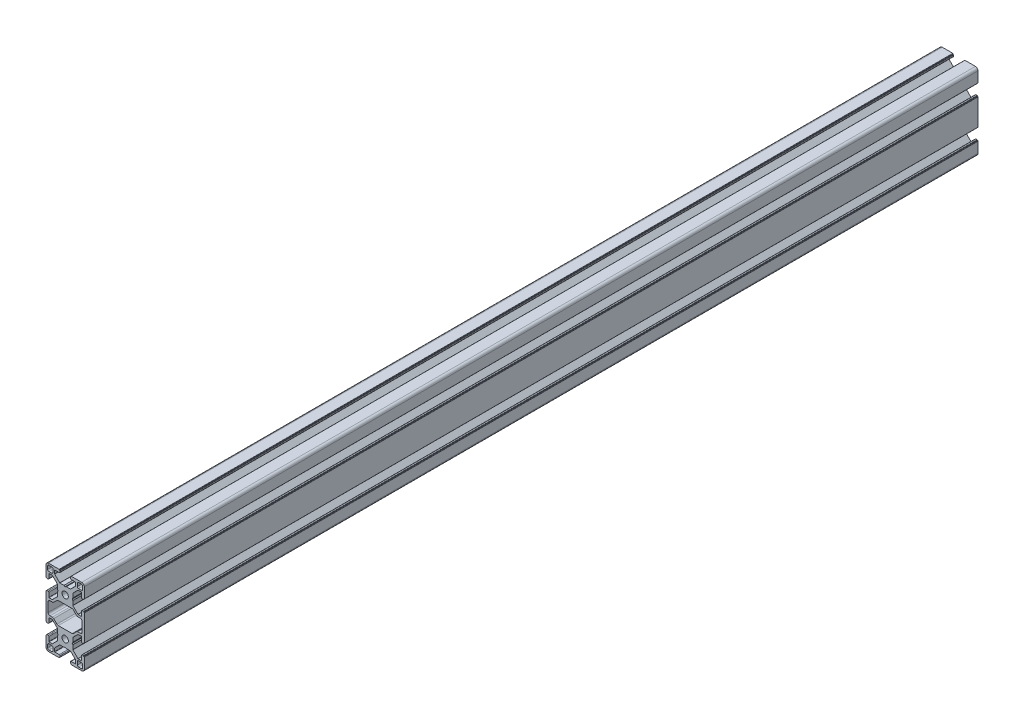
from build123d import *

# Parameters (mm, degrees)
SKETCH1_R                 = 2.45
BOSS_EXTRUDE1_DEPTH       = 700
SKETCH2_R                 = 3
CUT_EXTRUDE1_DEPTH        = 678.163200418
SKETCH3_R                 = 3
CUT_EXTRUDE2_DEPTH        = 678.827411761
M6X1_0_TAPPED_HOLE1_D     = 5
M6X1_0_TAPPED_HOLE1_DEPTH = 28
M6X1_0_TAPPED_HOLE1_TIP   = 1.502151548
M6X1_0_TAPPED_HOLE2_D     = 5
M6X1_0_TAPPED_HOLE2_DEPTH = 28
M6X1_0_TAPPED_HOLE2_TIP   = 1.502151548


with BuildPart() as part:
    # Sketch1 → Boss-Extrude1 (new body)
    with BuildSketch(Plane.XY.offset(25)):
        with BuildLine():
            Line((13.400000821, -25.95), (14.300000334, -25.95))
            ThreePointArc((14.300000334, -25.95), (14.44142169, -25.891421356), (14.500000334, -25.75))
            Line((14.500000334, -25.75), (14.500000334, -25.65))
            ThreePointArc((14.500000334, -25.65), (14.558578978, -25.508578644), (14.700000334, -25.45))
            Line((14.700000334, -25.45), (14.8, -25.45))
            ThreePointArc((14.8, -25.45), (14.941421356, -25.391421356), (15, -25.25))
            Line((15, -25.25), (15, -4.75))
            ThreePointArc((15, -4.75), (14.941421356, -4.608578644), (14.8, -4.55))
            Line((14.8, -4.55), (14.700000334, -4.55))
            ThreePointArc((14.700000334, -4.55), (14.558578978, -4.491421356), (14.500000334, -4.35))
            Line((14.500000334, -4.35), (14.500000334, -4.25))
            ThreePointArc((14.500000334, -4.25), (14.44142169, -4.108578644), (14.300000334, -4.05))
            Line((14.300000334, -4.05), (13.400000821, -4.05))
            ThreePointArc((13.400000821, -4.05), (12.975736752, -4.225735931), (12.800000821, -4.65))
            Line((12.800000821, -4.65), (12.800000821, -8.05))
            ThreePointArc((12.800000821, -8.05), (12.741422177, -8.191421356), (12.600000821, -8.25))
            Line((12.600000821, -8.25), (10.132847586, -8.25))
            ThreePointArc((10.132847586, -8.25), (10.056310912, -8.234775911), (9.991426248, -8.191421374))
            Line((9.991426248, -8.191421374), (6.06304592, -4.263042046))
            ThreePointArc((6.06304592, -4.263042046), (6.019691356, -4.19815737), (6.004467258, -4.121620672))
            Line((6.004467258, -4.121620672), (6.004467258, -0.90000009))
            Line((6.004467258, -0.90000009), (5.542586948, -0.099999736))
            ThreePointArc((5.542586948, -0.099999736), (5.515792105, 0), (5.542586948, 0.099999736))
            Line((5.542586948, 0.099999736), (6.004467258, 0.90000009))
            Line((6.004467258, 0.90000009), (6.004467258, 4.121623437))
            ThreePointArc((6.004467258, 4.121623437), (6.019691347, 4.198160112), (6.063045884, 4.263044775))
            Line((6.063045884, 4.263044775), (9.991421447, 8.191421338))
            ThreePointArc((9.991421447, 8.191421338), (10.056306123, 8.234775902), (10.132842821, 8.25))
            Line((10.132842821, 8.25), (12.600000821, 8.25))
            ThreePointArc((12.600000821, 8.25), (12.741422177, 8.191421356), (12.800000821, 8.05))
            Line((12.800000821, 8.05), (12.800000821, 4.65))
            ThreePointArc((12.800000821, 4.65), (12.975736752, 4.225735931), (13.400000821, 4.05))
            Line((13.400000821, 4.05), (14.300000334, 4.05))
            ThreePointArc((14.300000334, 4.05), (14.44142169, 4.108578644), (14.500000334, 4.25))
            Line((14.500000334, 4.25), (14.500000334, 4.350000125))
            ThreePointArc((14.500000334, 4.350000125), (14.558578978, 4.491421481), (14.700000334, 4.550000125))
            Line((14.700000334, 4.550000125), (14.8, 4.550000125))
            ThreePointArc((14.8, 4.550000125), (14.941421356, 4.608578769), (15, 4.750000125))
            Line((15, 4.750000125), (15, 13))
            ThreePointArc((15, 13), (14.414213562, 14.414213562), (13, 15))
            Line((13, 15), (4.75, 15))
            ThreePointArc((4.75, 15), (4.608578644, 14.941421356), (4.55, 14.8))
            Line((4.55, 14.8), (4.55, 14.7))
            ThreePointArc((4.55, 14.7), (4.491421356, 14.558578644), (4.35, 14.5))
            Line((4.35, 14.5), (4.25, 14.5))
            ThreePointArc((4.25, 14.5), (4.108578644, 14.441421356), (4.05, 14.3))
            Line((4.05, 14.3), (4.05, 13.4))
            ThreePointArc((4.05, 13.4), (4.225735931, 12.975735931), (4.65, 12.8))
            Line((4.65, 12.8), (8.05, 12.8))
            ThreePointArc((8.05, 12.8), (8.191421356, 12.741421356), (8.25, 12.6))
            Line((8.25, 12.6), (8.25, 10.132847492))
            ThreePointArc((8.25, 10.132847492), (8.234775904, 10.056310778), (8.191421344, 9.991426082))
            Line((8.191421344, 9.991426082), (4.258574852, 6.058578588))
            ThreePointArc((4.258574852, 6.058578588), (4.193690258, 6.015224079), (4.117153656, 6))
            Line((4.117153656, 6), (0.899999648, 6))
            Line((0.899999648, 6), (0.101934004, 5.53923672))
            ThreePointArc((0.101934004, 5.53923672), (0, 5.511923593), (-0.101934004, 5.53923672))
            Line((-0.101934004, 5.53923672), (-0.899999648, 6))
            Line((-0.899999648, 6), (-4.117156145, 6))
            ThreePointArc((-4.117156145, 6), (-4.193692724, 6.015224069), (-4.258577305, 6.058578552))
            Line((-4.258577305, 6.058578552), (-8.191421308, 9.991421554))
            ThreePointArc((-8.191421308, 9.991421554), (-8.234775894, 10.056306263), (-8.25, 10.132843))
            Line((-8.25, 10.132843), (-8.25, 12.6))
            ThreePointArc((-8.25, 12.6), (-8.191421356, 12.741421356), (-8.05, 12.8))
            Line((-8.05, 12.8), (-4.65, 12.8))
            ThreePointArc((-4.65, 12.8), (-4.225735931, 12.975735931), (-4.05, 13.4))
            Line((-4.05, 13.4), (-4.05, 14.3))
            ThreePointArc((-4.05, 14.3), (-4.108578644, 14.441421356), (-4.25, 14.5))
            Line((-4.25, 14.5), (-4.35, 14.5))
            ThreePointArc((-4.35, 14.5), (-4.491421356, 14.558578644), (-4.55, 14.7))
            Line((-4.55, 14.7), (-4.55, 14.8))
            ThreePointArc((-4.55, 14.8), (-4.608578644, 14.941421356), (-4.75, 15))
            Line((-4.75, 15), (-13, 15))
            ThreePointArc((-13, 15), (-14.414213562, 14.414213562), (-15, 13))
            Line((-15, 13), (-15, 4.750000125))
            ThreePointArc((-15, 4.750000125), (-14.941421356, 4.608578769), (-14.8, 4.550000125))
            Line((-14.8, 4.550000125), (-14.700000334, 4.550000125))
            ThreePointArc((-14.700000334, 4.550000125), (-14.558578978, 4.491421481), (-14.500000334, 4.350000125))
            Line((-14.500000334, 4.350000125), (-14.500000334, 4.25))
            ThreePointArc((-14.500000334, 4.25), (-14.44142169, 4.108578644), (-14.300000334, 4.05))
            Line((-14.300000334, 4.05), (-13.400000821, 4.05))
            ThreePointArc((-13.400000821, 4.05), (-12.975736752, 4.225735931), (-12.800000821, 4.65))
            Line((-12.800000821, 4.65), (-12.800000821, 8.05))
            ThreePointArc((-12.800000821, 8.05), (-12.741422177, 8.191421356), (-12.600000821, 8.25))
            Line((-12.600000821, 8.25), (-10.132842821, 8.25))
            ThreePointArc((-10.132842821, 8.25), (-10.056306123, 8.234775902), (-9.991421447, 8.191421338))
            Line((-9.991421447, 8.191421338), (-6.063045884, 4.263044775))
            ThreePointArc((-6.063045884, 4.263044775), (-6.019691347, 4.198160112), (-6.004467258, 4.121623437))
            Line((-6.004467258, 4.121623437), (-6.004467258, 0.90000009))
            Line((-6.004467258, 0.90000009), (-5.542586948, 0.099999736))
            ThreePointArc((-5.542586948, 0.099999736), (-5.515792105, 0), (-5.542586948, -0.099999736))
            Line((-5.542586948, -0.099999736), (-6.004467258, -0.90000009))
            Line((-6.004467258, -0.90000009), (-6.004467258, -4.121623437))
            ThreePointArc((-6.004467258, -4.121623437), (-6.019691347, -4.198160112), (-6.063045884, -4.263044775))
            Line((-6.063045884, -4.263044775), (-9.991421447, -8.191421338))
            ThreePointArc((-9.991421447, -8.191421338), (-10.056306123, -8.234775902), (-10.132842821, -8.25))
            Line((-10.132842821, -8.25), (-12.600000821, -8.25))
            ThreePointArc((-12.600000821, -8.25), (-12.741422177, -8.191421356), (-12.800000821, -8.05))
            Line((-12.800000821, -8.05), (-12.800000821, -4.65))
            ThreePointArc((-12.800000821, -4.65), (-12.975736752, -4.225735931), (-13.400000821, -4.05))
            Line((-13.400000821, -4.05), (-14.300000334, -4.05))
            ThreePointArc((-14.300000334, -4.05), (-14.44142169, -4.108578644), (-14.500000334, -4.25))
            Line((-14.500000334, -4.25), (-14.500000334, -4.35))
            ThreePointArc((-14.500000334, -4.35), (-14.558578978, -4.491421356), (-14.700000334, -4.55))
            Line((-14.700000334, -4.55), (-14.8, -4.55))
            ThreePointArc((-14.8, -4.55), (-14.941421356, -4.608578644), (-15, -4.75))
            Line((-15, -4.75), (-15, -25.25))
            ThreePointArc((-15, -25.25), (-14.941421356, -25.391421356), (-14.8, -25.45))
            Line((-14.8, -25.45), (-14.700000334, -25.45))
            ThreePointArc((-14.700000334, -25.45), (-14.558578978, -25.508578644), (-14.500000334, -25.65))
            Line((-14.500000334, -25.65), (-14.500000334, -25.75))
            ThreePointArc((-14.500000334, -25.75), (-14.44142169, -25.891421356), (-14.300000334, -25.95))
            Line((-14.300000334, -25.95), (-13.400000821, -25.95))
            ThreePointArc((-13.400000821, -25.95), (-12.975736752, -25.774264069), (-12.800000821, -25.35))
            Line((-12.800000821, -25.35), (-12.800000821, -21.95))
            ThreePointArc((-12.800000821, -21.95), (-12.741422177, -21.808578644), (-12.600000821, -21.75))
            Line((-12.600000821, -21.75), (-10.132842821, -21.75))
            ThreePointArc((-10.132842821, -21.75), (-10.056306123, -21.765224098), (-9.991421447, -21.808578662))
            Line((-9.991421447, -21.808578662), (-6.063045884, -25.736955225))
            ThreePointArc((-6.063045884, -25.736955225), (-6.019691347, -25.801839888), (-6.004467258, -25.878376563))
            Line((-6.004467258, -25.878376563), (-6.004467258, -29.09999991))
            Line((-6.004467258, -29.09999991), (-5.542586948, -29.900000264))
            ThreePointArc((-5.542586948, -29.900000264), (-5.515792105, -30), (-5.542586948, -30.099999736))
            Line((-5.542586948, -30.099999736), (-6.004467258, -30.90000009))
            Line((-6.004467258, -30.90000009), (-6.004467258, -34.121623437))
            ThreePointArc((-6.004467258, -34.121623437), (-6.019691347, -34.198160112), (-6.063045884, -34.263044775))
            Line((-6.063045884, -34.263044775), (-9.991421447, -38.191421338))
            ThreePointArc((-9.991421447, -38.191421338), (-10.056306123, -38.234775902), (-10.132842821, -38.25))
            Line((-10.132842821, -38.25), (-12.600000821, -38.25))
            ThreePointArc((-12.600000821, -38.25), (-12.741422177, -38.191421356), (-12.800000821, -38.05))
            Line((-12.800000821, -38.05), (-12.800000821, -34.65))
            ThreePointArc((-12.800000821, -34.65), (-12.975736752, -34.225735931), (-13.400000821, -34.05))
            Line((-13.400000821, -34.05), (-14.300000334, -34.05))
            ThreePointArc((-14.300000334, -34.05), (-14.44142169, -34.108578644), (-14.500000334, -34.25))
            Line((-14.500000334, -34.25), (-14.500000334, -34.350000125))
            ThreePointArc((-14.500000334, -34.350000125), (-14.558578978, -34.491421481), (-14.700000334, -34.550000125))
            Line((-14.700000334, -34.550000125), (-14.8, -34.550000125))
            ThreePointArc((-14.8, -34.550000125), (-14.941421356, -34.608578769), (-15, -34.750000125))
            Line((-15, -34.750000125), (-15, -43))
            ThreePointArc((-15, -43), (-14.414213562, -44.414213562), (-13, -45))
            Line((-13, -45), (-4.75, -45))
            ThreePointArc((-4.75, -45), (-4.608578644, -44.941421356), (-4.55, -44.8))
            Line((-4.55, -44.8), (-4.55, -44.7))
            ThreePointArc((-4.55, -44.7), (-4.491421356, -44.558578644), (-4.35, -44.5))
            Line((-4.35, -44.5), (-4.25, -44.5))
            ThreePointArc((-4.25, -44.5), (-4.108578644, -44.441421356), (-4.05, -44.3))
            Line((-4.05, -44.3), (-4.05, -43.4))
            ThreePointArc((-4.05, -43.4), (-4.225735931, -42.975735931), (-4.65, -42.8))
            Line((-4.65, -42.8), (-8.05, -42.8))
            ThreePointArc((-8.05, -42.8), (-8.191421356, -42.741421356), (-8.25, -42.6))
            Line((-8.25, -42.6), (-8.25, -40.132843))
            ThreePointArc((-8.25, -40.132843), (-8.234775894, -40.056306263), (-8.191421308, -39.991421554))
            Line((-8.191421308, -39.991421554), (-4.258577305, -36.058578552))
            ThreePointArc((-4.258577305, -36.058578552), (-4.193692724, -36.015224069), (-4.117156145, -36))
            Line((-4.117156145, -36), (-0.899999648, -36))
            Line((-0.899999648, -36), (-0.101934004, -35.53923672))
            ThreePointArc((-0.101934004, -35.53923672), (0, -35.511923593), (0.101934004, -35.53923672))
            Line((0.101934004, -35.53923672), (0.899999648, -36))
            Line((0.899999648, -36), (4.117153656, -36))
            ThreePointArc((4.117153656, -36), (4.193690258, -36.015224079), (4.258574852, -36.058578588))
            Line((4.258574852, -36.058578588), (8.191421344, -39.991426082))
            ThreePointArc((8.191421344, -39.991426082), (8.234775904, -40.056310778), (8.25, -40.132847492))
            Line((8.25, -40.132847492), (8.25, -42.6))
            ThreePointArc((8.25, -42.6), (8.191421356, -42.741421356), (8.05, -42.8))
            Line((8.05, -42.8), (4.65, -42.8))
            ThreePointArc((4.65, -42.8), (4.225735931, -42.975735931), (4.05, -43.4))
            Line((4.05, -43.4), (4.05, -44.3))
            ThreePointArc((4.05, -44.3), (4.108578644, -44.441421356), (4.25, -44.5))
            Line((4.25, -44.5), (4.35, -44.5))
            ThreePointArc((4.35, -44.5), (4.491421356, -44.558578644), (4.55, -44.7))
            Line((4.55, -44.7), (4.55, -44.8))
            ThreePointArc((4.55, -44.8), (4.608578644, -44.941421356), (4.75, -45))
            Line((4.75, -45), (13, -45))
            ThreePointArc((13, -45), (14.414213562, -44.414213562), (15, -43))
            Line((15, -43), (15, -34.750000125))
            ThreePointArc((15, -34.750000125), (14.941421356, -34.608578769), (14.8, -34.550000125))
            Line((14.8, -34.550000125), (14.700000334, -34.550000125))
            ThreePointArc((14.700000334, -34.550000125), (14.558578978, -34.491421481), (14.500000334, -34.350000125))
            Line((14.500000334, -34.350000125), (14.500000334, -34.25))
            ThreePointArc((14.500000334, -34.25), (14.44142169, -34.108578644), (14.300000334, -34.05))
            Line((14.300000334, -34.05), (13.400000821, -34.05))
            ThreePointArc((13.400000821, -34.05), (12.975736752, -34.225735931), (12.800000821, -34.65))
            Line((12.800000821, -34.65), (12.800000821, -38.05))
            ThreePointArc((12.800000821, -38.05), (12.741422177, -38.191421356), (12.600000821, -38.25))
            Line((12.600000821, -38.25), (10.132842821, -38.25))
            ThreePointArc((10.132842821, -38.25), (10.056306123, -38.234775902), (9.991421447, -38.191421338))
            Line((9.991421447, -38.191421338), (6.063045884, -34.263044775))
            ThreePointArc((6.063045884, -34.263044775), (6.019691347, -34.198160112), (6.004467258, -34.121623437))
            Line((6.004467258, -34.121623437), (6.004467258, -30.90000009))
            Line((6.004467258, -30.90000009), (5.542586948, -30.099999736))
            ThreePointArc((5.542586948, -30.099999736), (5.515792105, -30), (5.542586948, -29.900000264))
            Line((5.542586948, -29.900000264), (6.004467258, -29.09999991))
            Line((6.004467258, -29.09999991), (6.004467258, -25.878379328))
            ThreePointArc((6.004467258, -25.878379328), (6.019691356, -25.80184263), (6.06304592, -25.736957954))
            Line((6.06304592, -25.736957954), (9.991426248, -21.808578626))
            ThreePointArc((9.991426248, -21.808578626), (10.056310912, -21.765224089), (10.132847586, -21.75))
            Line((10.132847586, -21.75), (12.600000821, -21.75))
            ThreePointArc((12.600000821, -21.75), (12.741422177, -21.808578644), (12.800000821, -21.95))
            Line((12.800000821, -21.95), (12.800000821, -25.35))
            ThreePointArc((12.800000821, -25.35), (12.975736752, -25.774264069), (13.400000821, -25.95))
        make_face()
        Circle(SKETCH1_R, mode=Mode.SUBTRACT)
        with Locations((0, -30)):
            Circle(SKETCH1_R, mode=Mode.SUBTRACT)
        with BuildLine():
            Line((-9.500000904, 12.700000174), (-9.500000904, 10.500000174))
            ThreePointArc((-9.500000904, 10.500000174), (-9.792894123, 9.792893393), (-10.500000904, 9.500000174))
            Line((-10.500000904, 9.500000174), (-12.700000904, 9.500000174))
            ThreePointArc((-12.700000904, 9.500000174), (-13.407107685, 9.792893393), (-13.700000904, 10.500000174))
            Line((-13.700000904, 10.500000174), (-13.700000904, 12.700000174))
            ThreePointArc((-13.700000904, 12.700000174), (-13.407107685, 13.407106955), (-12.700000904, 13.700000174))
            Line((-12.700000904, 13.700000174), (-10.500000904, 13.700000174))
            ThreePointArc((-10.500000904, 13.700000174), (-9.792894123, 13.407106955), (-9.500000904, 12.700000174))
        make_face(mode=Mode.SUBTRACT)
        with BuildLine():
            Line((12.700000904, 9.500000174), (10.500000904, 9.500000174))
            ThreePointArc((10.500000904, 9.500000174), (9.792894123, 9.792893393), (9.500000904, 10.500000174))
            Line((9.500000904, 10.500000174), (9.500000904, 12.700000174))
            ThreePointArc((9.500000904, 12.700000174), (9.792894123, 13.407106955), (10.500000904, 13.700000174))
            Line((10.500000904, 13.700000174), (12.700000904, 13.700000174))
            ThreePointArc((12.700000904, 13.700000174), (13.407107685, 13.407106955), (13.700000904, 12.700000174))
            Line((13.700000904, 12.700000174), (13.700000904, 10.500000174))
            ThreePointArc((13.700000904, 10.500000174), (13.407107685, 9.792893393), (12.700000904, 9.500000174))
        make_face(mode=Mode.SUBTRACT)
        with BuildLine():
            Line((-12.700000904, -39.500000174), (-10.500000904, -39.500000174))
            ThreePointArc((-10.500000904, -39.500000174), (-9.792894123, -39.792893393), (-9.500000904, -40.500000174))
            Line((-9.500000904, -40.500000174), (-9.500000904, -42.700000174))
            ThreePointArc((-9.500000904, -42.700000174), (-9.792894123, -43.407106955), (-10.500000904, -43.700000174))
            Line((-10.500000904, -43.700000174), (-12.700000904, -43.700000174))
            ThreePointArc((-12.700000904, -43.700000174), (-13.407107685, -43.407106955), (-13.700000904, -42.700000174))
            Line((-13.700000904, -42.700000174), (-13.700000904, -40.500000174))
            ThreePointArc((-13.700000904, -40.500000174), (-13.407107685, -39.792893393), (-12.700000904, -39.500000174))
        make_face(mode=Mode.SUBTRACT)
        with BuildLine():
            Line((9.500000904, -42.700000174), (9.500000904, -40.500000174))
            ThreePointArc((9.500000904, -40.500000174), (9.792894123, -39.792893393), (10.500000904, -39.500000174))
            Line((10.500000904, -39.500000174), (12.700000904, -39.500000174))
            ThreePointArc((12.700000904, -39.500000174), (13.407107685, -39.792893393), (13.700000904, -40.500000174))
            Line((13.700000904, -40.500000174), (13.700000904, -42.700000174))
            ThreePointArc((13.700000904, -42.700000174), (13.407107685, -43.407106955), (12.700000904, -43.700000174))
            Line((12.700000904, -43.700000174), (10.500000904, -43.700000174))
            ThreePointArc((10.500000904, -43.700000174), (9.792894123, -43.407106955), (9.500000904, -42.700000174))
        make_face(mode=Mode.SUBTRACT)
        with BuildLine():
            Line((8.927207746, -20.539339865), (6.410354062, -23.056193892))
            ThreePointArc((6.410354062, -23.056193892), (5.923719014, -23.381353072), (5.349693818, -23.495533793))
            Line((5.349693818, -23.495533793), (-5.349693818, -23.495533793))
            ThreePointArc((-5.349693818, -23.495533793), (-5.923719014, -23.381353072), (-6.410354062, -23.056193892))
            Line((-6.410354062, -23.056193892), (-8.927207746, -20.539339865))
            ThreePointArc((-8.927207746, -20.539339865), (-9.413842755, -20.214180712), (-9.987867904, -20.1))
            Line((-9.987867904, -20.1), (-11.849999904, -20.1))
            ThreePointArc((-11.849999904, -20.1), (-12.910660076, -19.660660172), (-13.349999904, -18.6))
            Line((-13.349999904, -18.6), (-13.349999904, -11.4))
            ThreePointArc((-13.349999904, -11.4), (-12.910660076, -10.339339828), (-11.849999904, -9.9))
            Line((-11.849999904, -9.9), (-9.987867904, -9.9))
            ThreePointArc((-9.987867904, -9.9), (-9.413842755, -9.785819288), (-8.927207746, -9.460660135))
            Line((-8.927207746, -9.460660135), (-6.410354062, -6.943806108))
            ThreePointArc((-6.410354062, -6.943806108), (-5.923719014, -6.618646928), (-5.349693818, -6.504466207))
            Line((-5.349693818, -6.504466207), (5.349693818, -6.504466207))
            ThreePointArc((5.349693818, -6.504466207), (5.923719014, -6.618646928), (6.410354062, -6.943806108))
            Line((6.410354062, -6.943806108), (8.927207746, -9.460660135))
            ThreePointArc((8.927207746, -9.460660135), (9.413842755, -9.785819288), (9.987867904, -9.9))
            Line((9.987867904, -9.9), (11.849999904, -9.9))
            ThreePointArc((11.849999904, -9.9), (12.910660076, -10.339339828), (13.349999904, -11.4))
            Line((13.349999904, -11.4), (13.349999904, -18.6))
            ThreePointArc((13.349999904, -18.6), (12.910660076, -19.660660172), (11.849999904, -20.1))
            Line((11.849999904, -20.1), (9.987867904, -20.1))
            ThreePointArc((9.987867904, -20.1), (9.413842755, -20.214180712), (8.927207746, -20.539339865))
        make_face(mode=Mode.SUBTRACT)
    extrude(amount=-BOSS_EXTRUDE1_DEPTH)

    # Sketch2 → Cut-Extrude1 (cut, through all)
    with BuildSketch(Plane(origin=(15, 0, 0), x_dir=(0, 0, -1), z_dir=(1, 0, 0))):
        with Locations(Location((20, 0, 0), (0, 0, 162.542395082))):
            Circle(SKETCH2_R)
        with Locations(Location((20, -30, 0), (0, 0, 162.542395082))):
            Circle(SKETCH2_R)
        with Locations(Location((660, 0, 0), (0, 0, 162.542395082))):
            Circle(SKETCH2_R)
        with Locations(Location((660, -30, 0), (0, 0, 17.457604918))):
            Circle(SKETCH2_R)
    extrude(amount=-CUT_EXTRUDE1_DEPTH, mode=Mode.SUBTRACT)

    # Sketch3 → Cut-Extrude2 (cut, through all)
    with BuildSketch(Plane.XZ.offset(45)):
        with Locations(Location((0, -20, 0), (0, 0, 268.052830131))):
            Circle(SKETCH3_R)
        with Locations(Location((0, -660, 0), (0, 0, 270))):
            Circle(SKETCH3_R)
    extrude(amount=-CUT_EXTRUDE2_DEPTH, mode=Mode.SUBTRACT)

    # M6x1.0 Tapped Hole1
    with Locations(Plane.XY.offset(25)):
        with Locations((0, 0), (0, -30)):
            Hole(M6X1_0_TAPPED_HOLE1_D / 2, depth=M6X1_0_TAPPED_HOLE1_DEPTH)
            with Locations((0, 0, -(M6X1_0_TAPPED_HOLE1_DEPTH + M6X1_0_TAPPED_HOLE1_TIP / 2))):  # 118° drill point
                Cone(0, M6X1_0_TAPPED_HOLE1_D / 2, M6X1_0_TAPPED_HOLE1_TIP, mode=Mode.SUBTRACT)

    # M6x1.0 Tapped Hole2
    with Locations(Plane(origin=(0, 0, -675), x_dir=(-1, 0, 0), z_dir=(0, 0, -1))):
        with Locations((0, 0), (0, -30)):
            Hole(M6X1_0_TAPPED_HOLE2_D / 2, depth=M6X1_0_TAPPED_HOLE2_DEPTH)
            with Locations((0, 0, -(M6X1_0_TAPPED_HOLE2_DEPTH + M6X1_0_TAPPED_HOLE2_TIP / 2))):  # 118° drill point
                Cone(0, M6X1_0_TAPPED_HOLE2_D / 2, M6X1_0_TAPPED_HOLE2_TIP, mode=Mode.SUBTRACT)


solid = part.part
